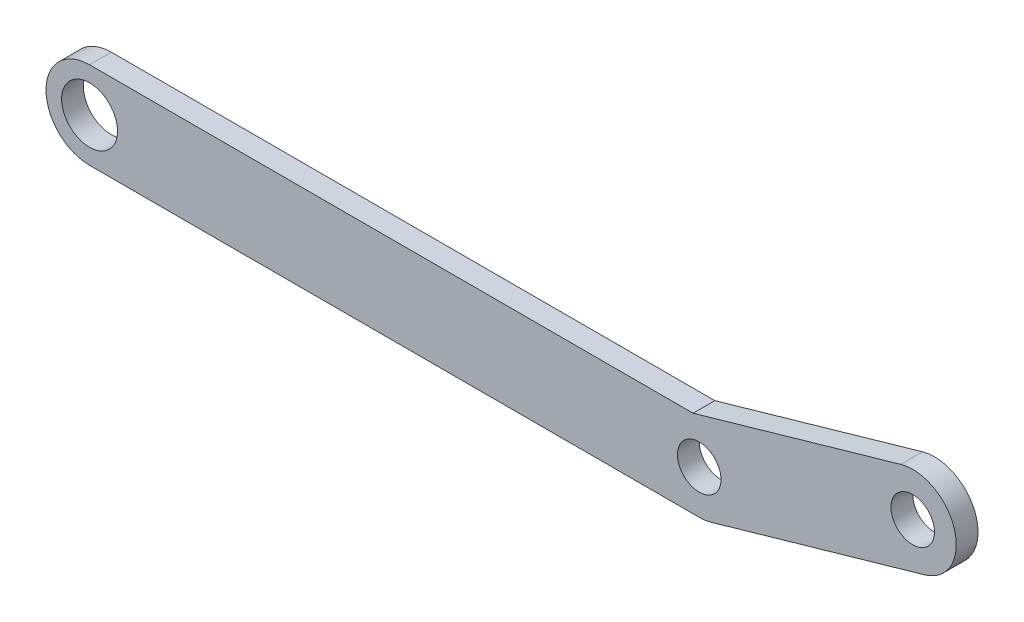
from build123d import *

# Parameters (mm, degrees)
CROQUIS1_R              = 5
CROQUIS1_R_2            = 6.417351574
SALIENTE_EXTRUIR1_DEPTH = 5


with BuildPart() as part:
    # Croquis1 → Saliente-Extruir1 (new body)
    with BuildSketch(Plane.XY):
        with BuildLine():
            Line((-70, 10), (68.594591653, 10))
            Line((68.594591653, 10), (116.267972935, 23.670122106))
            ThreePointArc((116.267972935, 23.670122106), (128.636963452, 16.813878705), (121.780720051, 4.444888187))
            Line((121.780720051, 4.444888187), (72.756373558, -9.612616959))
            ThreePointArc((72.756373558, -9.612616959), (71.39173101, -9.902680687), (70, -10))
            Line((70, -10), (-70, -10))
            ThreePointArc((-70, -10), (-80, 0), (-70, 10))
        make_face()
        with Locations((70, 0)):
            Circle(CROQUIS1_R, mode=Mode.SUBTRACT)
        with Locations((119.024346493, 14.057505147)):
            Circle(CROQUIS1_R, mode=Mode.SUBTRACT)
        with Locations((-70, 0)):
            Circle(CROQUIS1_R_2, mode=Mode.SUBTRACT)
    extrude(amount=SALIENTE_EXTRUIR1_DEPTH)


solid = part.part
